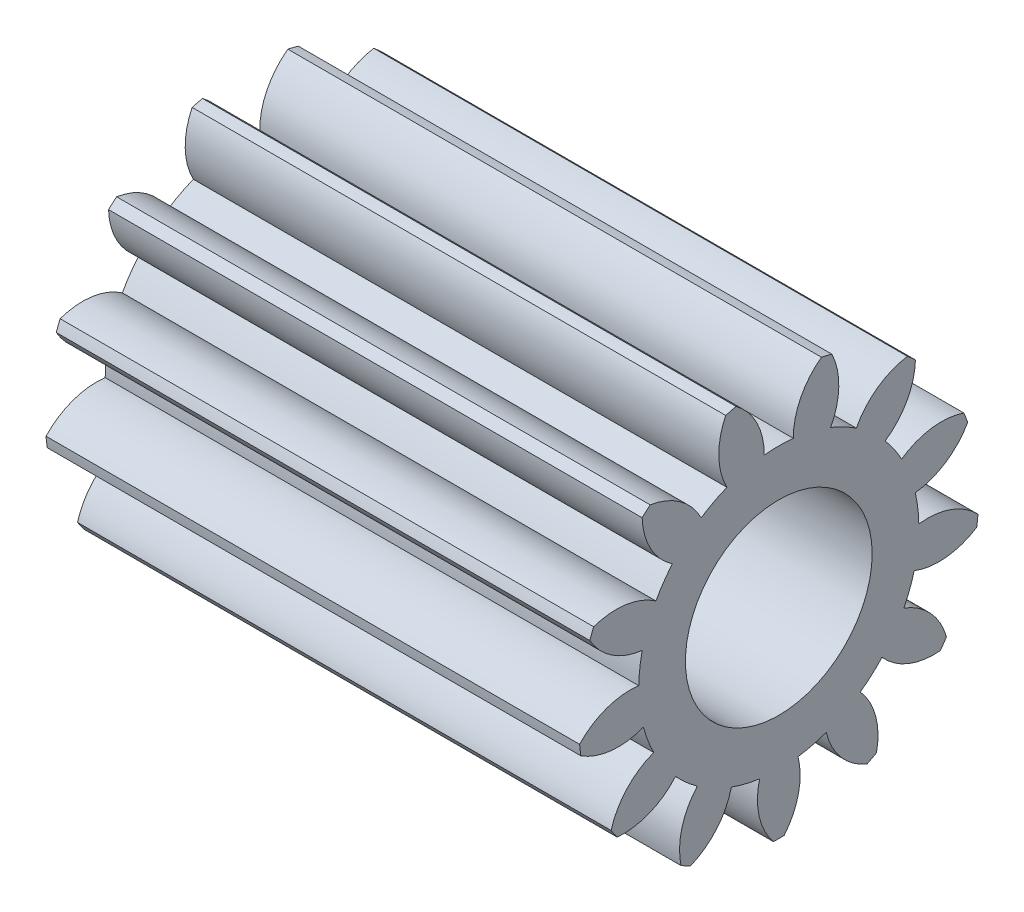
from build123d import *

# Parameters (mm, degrees)
BASPROSKE_W         = 40
BASPROSKE_H         = 15
TOOTHCUT_DEPTH      = 46.276925691
TEETHCUTS_COUNT     = 13
TEETHCUTS_ANGLE     = 332.307692308
BORSKE_R            = 1
BORE_DEPTH          = 50.0000508
SKETCH_2_R          = 7
CUT_EXTRUDE_1_DEPTH = 17


with BuildPart() as part:
    # BasProSke → Base-Revolve (revolve)
    with BuildSketch(Plane(origin=(0, 0, 0), x_dir=(1, 0, 0), z_dir=(0, 1, 0)), mode=Mode.PRIVATE) as base_revolve_sk:
        with Locations((20, 7.5)):
            Rectangle(BASPROSKE_W, BASPROSKE_H)
    revolve(base_revolve_sk.sketch.rotate(Axis((-10, 0, 0), (1, 0, 0)), 180), axis=Axis((-10, 0, 0), (1, 0, 0)))

    # TooCutSke → ToothCut (cut, through all)
    with BuildSketch(Plane(origin=(0, 0, 0), x_dir=(0, 0, -1), z_dir=(1, 0, 0))):
        with BuildLine():
            ThreePointArc((1.088245291, 10.442448141), (0, 10.499), (-1.088245291, 10.442448141))
            ThreePointArc((-1.088245291, 10.442448141), (-1.646045958, 12.816546547), (-3.224884568, 14.675243258))
            ThreePointArc((-3.224884568, 14.675243258), (0, 15.0254), (3.224884568, 14.675243258))
            ThreePointArc((3.224884568, 14.675243258), (1.646045958, 12.816546547), (1.088245291, 10.442448141))
        make_face()
    toothcut = extrude(amount=TOOTHCUT_DEPTH, mode=Mode.SUBTRACT)

    # TeethCuts: ToothCut ×13 about axis
    teethcuts_axis = Axis((-10, 0, 0), (1, 0, 0))
    for i in range(1, TEETHCUTS_COUNT):
        add(toothcut.rotate(teethcuts_axis, i * TEETHCUTS_ANGLE / (TEETHCUTS_COUNT - 1)), mode=Mode.SUBTRACT)

    # BorSke → Bore (cut, symmetric)
    with BuildSketch(Plane(origin=(0, 0, 0), x_dir=(0, 0, -1), z_dir=(1, 0, 0))):
        with Locations(Location((0, 0, 0), (0, 0, 180))):
            Circle(BORSKE_R)
    extrude(amount=BORE_DEPTH, both=True, mode=Mode.SUBTRACT)

    # 草图2 → 切除-拉伸1 (cut)
    with BuildSketch(Plane(origin=(40, 0, 0), x_dir=(0, 0, -1), z_dir=(1, 0, 0))):
        Circle(SKETCH_2_R)
    extrude(amount=-CUT_EXTRUDE_1_DEPTH, mode=Mode.SUBTRACT)


solid = part.part
